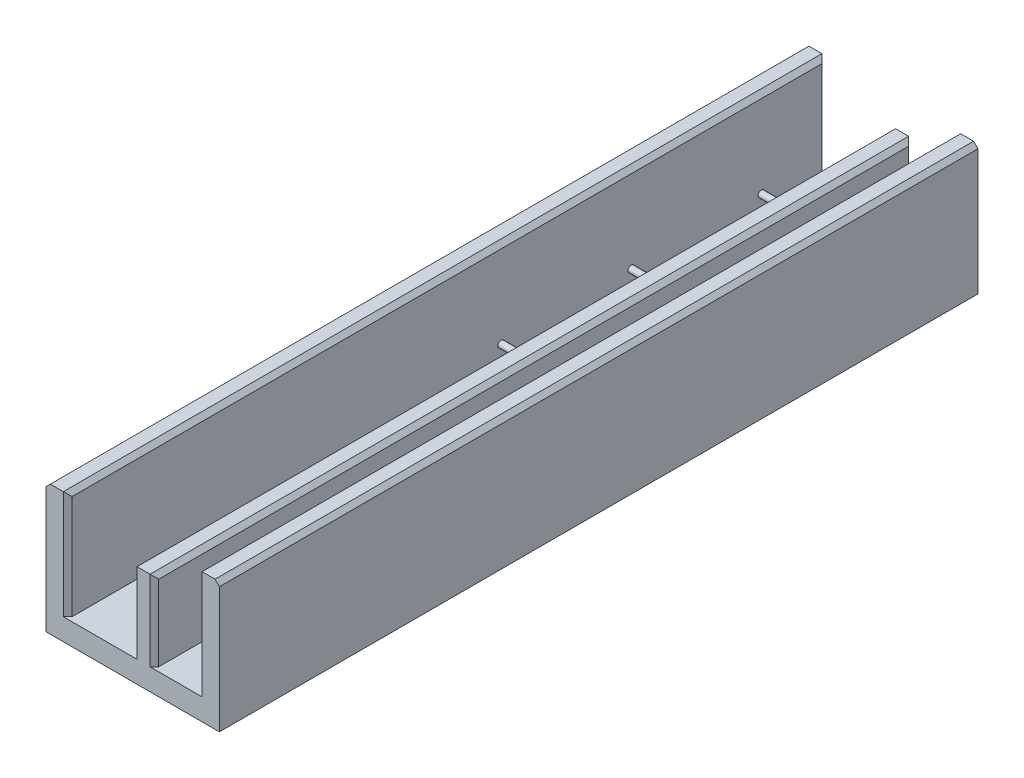
from build123d import *

# Parameters (mm, degrees)
SALIENTE_EXTRUIR1_DEPTH = 3500
CHAFL_N2_SIZE           = 20
SALIENTE_EXTRUIR2_REACH = 3642.055
CROQUIS2_R              = 15
MATRIZL1_COUNT          = 3
MATRIZL1_PITCH          = 600


with BuildPart() as part:
    # Croquis1 → Saliente-Extruir1 (new body)
    with BuildSketch(Plane.XY):
        Polygon((0, 0), (-800, 0), (-800, 600), (-700, 600), (-700, 100), (-400, 100), (-400, 470), (-300, 470), (-300, 100), (-100, 100), (-100, 600), (0, 600), align=None)
    extrude(amount=SALIENTE_EXTRUIR1_DEPTH)

    # Chaflán2
    chafl_n2_edges = [part.edges().sort_by_distance(p)[0] for p in [
        (-100, 350, 3500),
        (-700, 350, 0),
        (-400, 285, 0),
        (-300, 285, 0),
        (-100, 350, 0),
        (-300, 285, 3500),
        (-800, 600, 1750),
        (-700, 600, 1750),
        (-400, 470, 1750),
        (-300, 470, 1750),
        (-100, 600, 1750),
        (0, 600, 1750),
        (-400, 285, 3500),
        (-700, 350, 3500),
    ]]
    chamfer(chafl_n2_edges, length=CHAFL_N2_SIZE)

    # Saliente-Extruir2: up to this face of the body (flat: up to its plane)
    saliente_extruir2_end = Plane(part.part.faces().sort_by_distance((-100, 340, 1750))[0])
    # Croquis2 → Saliente-Extruir2 (add, up to the picked face)
    with BuildSketch(Plane.ZY.offset(800), mode=Mode.PRIVATE) as saliente_extruir2_sk1:
        with Locations(Location((300, 200, 0), (0, 0, 270))):
            Circle(CROQUIS2_R)
    saliente_extruir2_tool1 = split(extrude(saliente_extruir2_sk1.sketch, amount=-SALIENTE_EXTRUIR2_REACH, mode=Mode.PRIVATE), bisect_by=saliente_extruir2_end, keep=Keep.BOTH, mode=Mode.PRIVATE)
    saliente_extruir2 = saliente_extruir2_tool1.solids().sort_by(Axis((-800, 200, 300), (1, 0, 0)))[0]
    add(saliente_extruir2)

    # MatrizL1: Saliente-Extruir2 ×3
    with Locations(*[(0, 0, i * MATRIZL1_PITCH) for i in range(1, MATRIZL1_COUNT)]):
        add(saliente_extruir2)


solid = part.part
